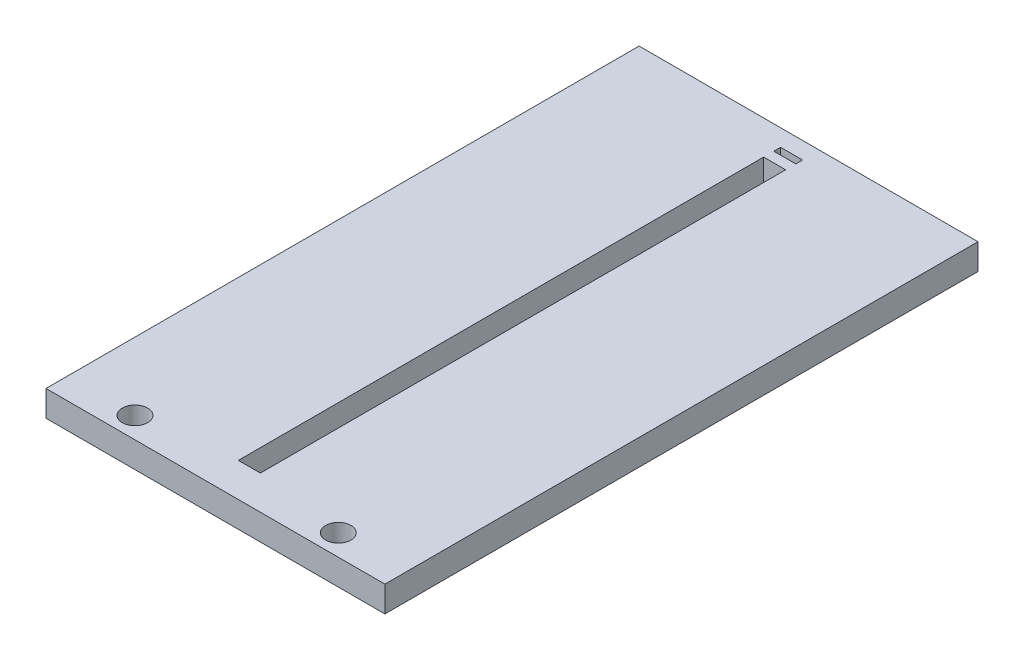
from build123d import *

# Parameters (mm, degrees)
SKETCH1_W           = 40
SKETCH1_H           = 70
BOSS_EXTRUDE1_DEPTH = 3.05
SKETCH4_W           = 2.6
SKETCH4_H           = 62
SKETCH4_H_2         = 0.8
CUT_EXTRUDE1_DEPTH  = 10
SKETCH7_R           = 1.5
CUT_EXTRUDE4_DEPTH  = 10


with BuildPart() as part:
    # Sketch1 → Boss-Extrude1 (new body)
    with BuildSketch(Plane(origin=(0, 0, 0), x_dir=(1, 0, 0), z_dir=(0, 1, 0))):
        with Locations((20, 35)):
            Rectangle(SKETCH1_W, SKETCH1_H)
    extrude(amount=BOSS_EXTRUDE1_DEPTH)

    # Sketch4 → Cut-Extrude1 (cut)
    with BuildSketch(Plane(origin=(0, 3.05, 0), x_dir=(1, 0, 0), z_dir=(0, 1, 0))):
        with Locations((20, 35)):
            Rectangle(SKETCH4_W, SKETCH4_H)
        with Locations((20, 67.6)):
            Rectangle(SKETCH4_W, SKETCH4_H_2)
    extrude(amount=-CUT_EXTRUDE1_DEPTH, mode=Mode.SUBTRACT)

    # Sketch7 → Cut-Extrude4 (cut)
    with BuildSketch(Plane(origin=(0, 3.05, 0), x_dir=(1, 0, 0), z_dir=(0, 1, 0))):
        with Locations(Location((8, 2.5, 0), (0, 0, 270))):
            Circle(SKETCH7_R)
        with Locations(Location((32, 2.5, 0), (0, 0, 270))):
            Circle(SKETCH7_R)
    extrude(amount=-CUT_EXTRUDE4_DEPTH, mode=Mode.SUBTRACT)


solid = part.part
